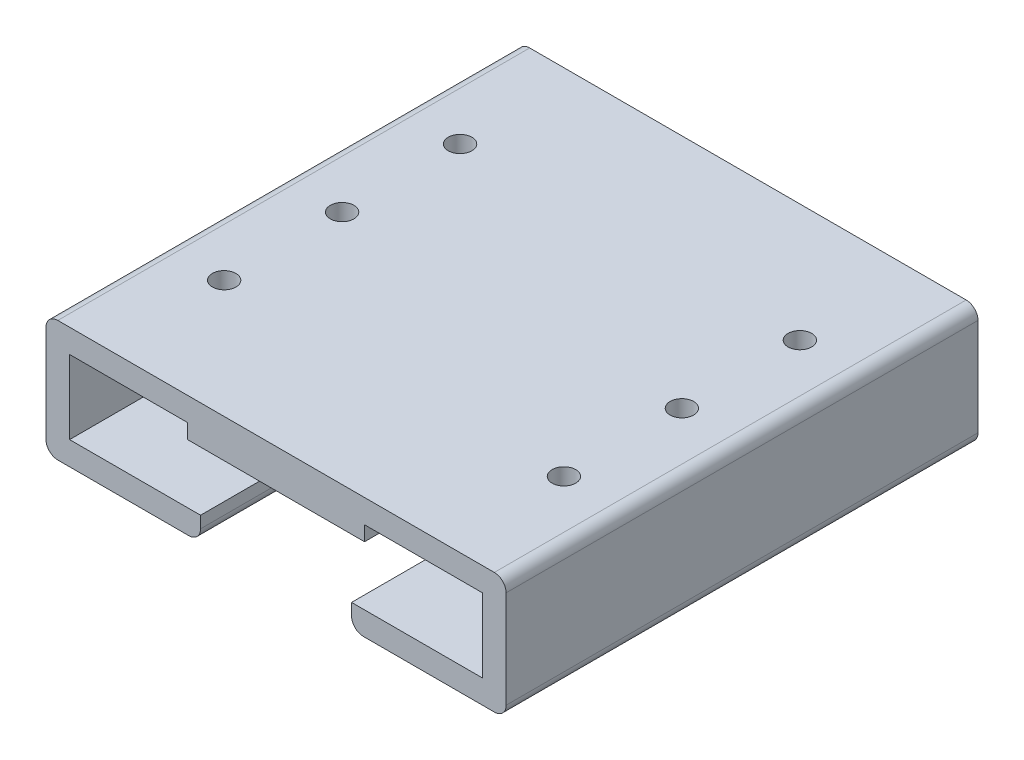
from build123d import *

# Parameters (mm, degrees)
BOSS_EXTRUDE1_DEPTH = 80
SKETCH2_R           = 2
CUT_EXTRUDE1_DEPTH  = 4
CUT_EXTRUDE2_START  = -4
SKETCH3_R           = 2
CUT_EXTRUDE2_DEPTH  = 4


with BuildPart() as part:
    # Sketch1 → Boss-Extrude1 (new body)
    with BuildSketch(Plane.XY):
        with BuildLine():
            Line((-15, 0), (15, 0))
            Line((15, 0), (15, 2.5))
            Line((15, 2.5), (35, 2.5))
            Line((35, 2.5), (35, -10))
            Line((35, -10), (12.8, -10))
            Line((12.8, -10), (12.8, -12))
            ThreePointArc((12.8, -12), (13.385786438, -13.414213562), (14.8, -14))
            Line((14.8, -14), (37, -14))
            ThreePointArc((37, -14), (38.414213562, -13.414213562), (39, -12))
            Line((39, -12), (39, 4.5))
            ThreePointArc((39, 4.5), (38.414213562, 5.914213562), (37, 6.5))
            Line((37, 6.5), (15, 6.5))
            Line((15, 6.5), (-15, 6.5))
            Line((-15, 6.5), (-37, 6.5))
            ThreePointArc((-37, 6.5), (-38.414213562, 5.914213562), (-39, 4.5))
            Line((-39, 4.5), (-39, -12))
            ThreePointArc((-39, -12), (-38.414213562, -13.414213562), (-37, -14))
            Line((-37, -14), (-14.8, -14))
            ThreePointArc((-14.8, -14), (-13.385786438, -13.414213562), (-12.8, -12))
            Line((-12.8, -12), (-12.8, -10))
            Line((-12.8, -10), (-35, -10))
            Line((-35, -10), (-35, 2.5))
            Line((-35, 2.5), (-15, 2.5))
            Line((-15, 2.5), (-15, 0))
        make_face()
    extrude(amount=BOSS_EXTRUDE1_DEPTH)

    # Sketch2 → Cut-Extrude1 (cut)
    with BuildSketch(Plane.XZ.offset(-2.5)):
        with Locations((-28.8, 60)):
            Circle(SKETCH2_R)
        with Locations((28.8, 60)):
            Circle(SKETCH2_R)
        with Locations((28.8, 40)):
            Circle(SKETCH2_R)
        with Locations((28.8, 20)):
            Circle(SKETCH2_R)
        with Locations((-28.8, 40)):
            Circle(SKETCH2_R)
        with Locations((-28.8, 20)):
            Circle(SKETCH2_R)
    extrude(amount=-CUT_EXTRUDE1_DEPTH, mode=Mode.SUBTRACT)

    # Sketch3 → Cut-Extrude2 (cut)
    with BuildSketch(Plane(origin=(0, -10, 0), x_dir=(1, 0, 0), z_dir=(0, 1, 0)).offset(CUT_EXTRUDE2_START)):
        with Locations((28.8, -40)):
            Circle(SKETCH3_R)
    extrude(amount=CUT_EXTRUDE2_DEPTH, mode=Mode.SUBTRACT)


solid = part.part
